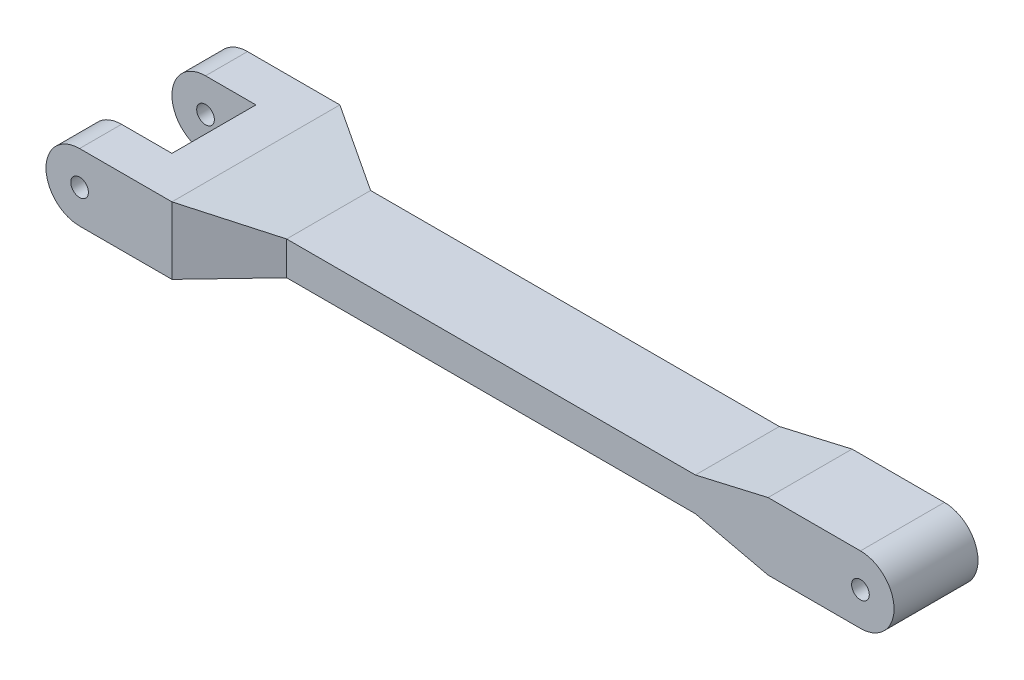
from build123d import *

# Parameters (mm, degrees)
SKETCH2_R               = 1.3375
BOSS_EXTRUDE2_DEPTH     = 25.4
SKETCH4_W               = 12.7
SKETCH4_H               = 12.7
CUT_EXTRUDE2_DEPTH      = 12.7
CUT_EXTRUDE3_DEPTH      = 110.534359325
CUT_EXTRUDE3_DEPTH_BACK = 110.534359325
SKETCH5_W               = 5.08
SKETCH5_H               = 6.35
CUT_EXTRUDE7_DEPTH      = 110.233274388


with BuildPart() as part:
    # Sketch2 → Boss-Extrude2 (new body)
    with BuildSketch(Plane.XY):
        with BuildLine():
            Line((-10.776857143, 6.112115909), (100.983142857, 6.112115909))
            ThreePointArc((100.983142857, 6.112115909), (106.063142857, 1.032115909), (100.983142857, -4.047884091))
            Line((100.983142857, -4.047884091), (-10.776857143, -4.047884091))
            ThreePointArc((-10.776857143, -4.047884091), (-15.856857143, 1.032115909), (-10.776857143, 6.112115909))
        make_face()
        with Locations((-10.776857143, 1.032115909)):
            Circle(SKETCH2_R, mode=Mode.SUBTRACT)
        with Locations((100.983142857, 1.032115909)):
            Circle(SKETCH2_R, mode=Mode.SUBTRACT)
    extrude(amount=BOSS_EXTRUDE2_DEPTH)

    # Sketch4 → Cut-Extrude2 (cut)
    with BuildSketch(Plane(origin=(0, 6.112115909, 0), x_dir=(1, 0, 0), z_dir=(0, 1, 0))):
        with Locations((-9.506857143, -12.7)):
            Rectangle(SKETCH4_W, SKETCH4_H)
    extrude(amount=-CUT_EXTRUDE2_DEPTH, mode=Mode.SUBTRACT)

    # Sketch5 → Cut-Extrude3 (cut, two sides: drawn at the far end of the back side and taken through both)
    with BuildSketch(Plane(origin=(0, 6.112115909, 0), x_dir=(1, 0, 0), z_dir=(0, 1, 0)).offset(-CUT_EXTRUDE3_DEPTH_BACK)):
        Polygon((87.013142857, 0), (3.193142857, 0), (14.191665485, -6.35), (100.983142857, -6.35), (100.983142857, 0), align=None)
        Polygon((100.983142857, -25.4), (100.983142857, -19.05), (14.191665485, -19.05), (3.193142857, -25.4), (87.013142857, -25.4), align=None)
        with Locations((103.523142857, -22.225)):
            Rectangle(SKETCH5_W, SKETCH5_H)
        with Locations((103.523142857, -3.175)):
            Rectangle(SKETCH5_W, SKETCH5_H)
    extrude(amount=CUT_EXTRUDE3_DEPTH + CUT_EXTRUDE3_DEPTH_BACK, mode=Mode.SUBTRACT)

    # Sketch13 → Cut-Extrude7 (cut, through all)
    with BuildSketch(Plane.XY.offset(25.4)):
        Polygon((87.013142857, 6.112115909), (76.014620229, 3.572115909), (14.191665485, 3.572115909), (3.193142857, 6.112115909), align=None)
        Polygon((87.013142857, -4.047884091), (3.193142857, -4.047884091), (14.191665485, -1.507884091), (76.014620229, -1.507884091), align=None)
    extrude(amount=-CUT_EXTRUDE7_DEPTH, mode=Mode.SUBTRACT)


solid = part.part
